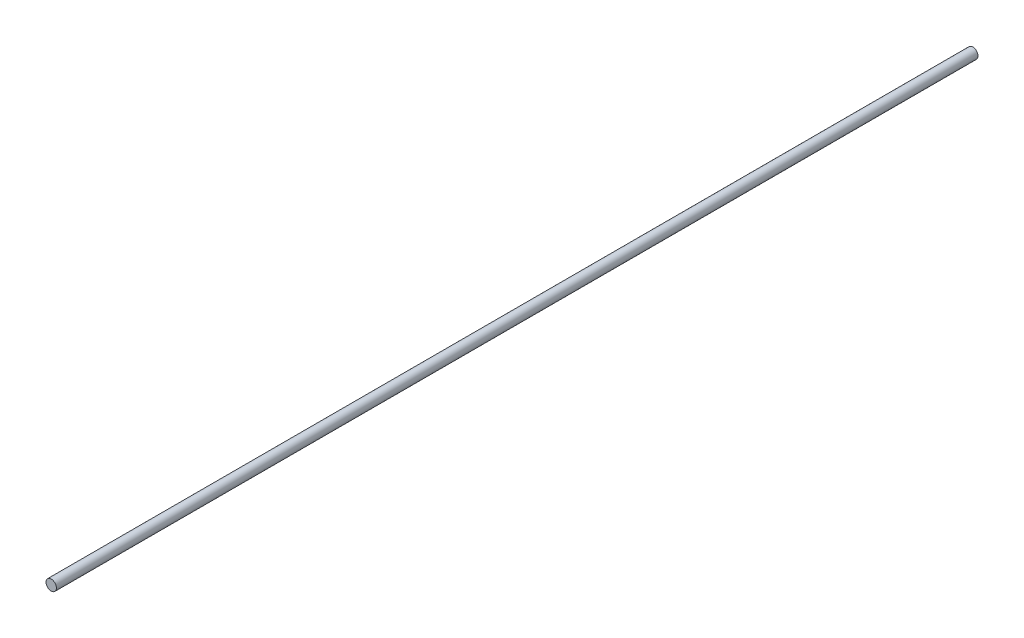
from build123d import *

# Parameters (mm, degrees)
SKETCH1_R           = 7.9375
BOSS_EXTRUDE1_DEPTH = 2254.25
SKETCH2_R           = 7.9375
CUT_EXTRUDE1_DEPTH  = 596.9
CUT_EXTRUDE2_START  = -254
SKETCH3_R           = 7.9375
CUT_EXTRUDE2_DEPTH  = 254


with BuildPart() as part:
    # Sketch1 → Boss-Extrude1 (new body)
    with BuildSketch(Plane.XY):
        Circle(SKETCH1_R)
    extrude(amount=BOSS_EXTRUDE1_DEPTH)

    # Sketch2 → Cut-Extrude1 (cut)
    with BuildSketch(Plane(origin=(0, 0, 0), x_dir=(-1, 0, 0), z_dir=(0, 0, -1))):
        Circle(SKETCH2_R)
    extrude(amount=-CUT_EXTRUDE1_DEPTH, mode=Mode.SUBTRACT)

    # Sketch3 → Cut-Extrude2 (cut)
    with BuildSketch(Plane.XY.offset(2254.25).offset(CUT_EXTRUDE2_START)):
        with Locations(Location((0, 0, 0), (0, 0, 180))):
            Circle(SKETCH3_R)
    extrude(amount=CUT_EXTRUDE2_DEPTH, mode=Mode.SUBTRACT)


solid = part.part
